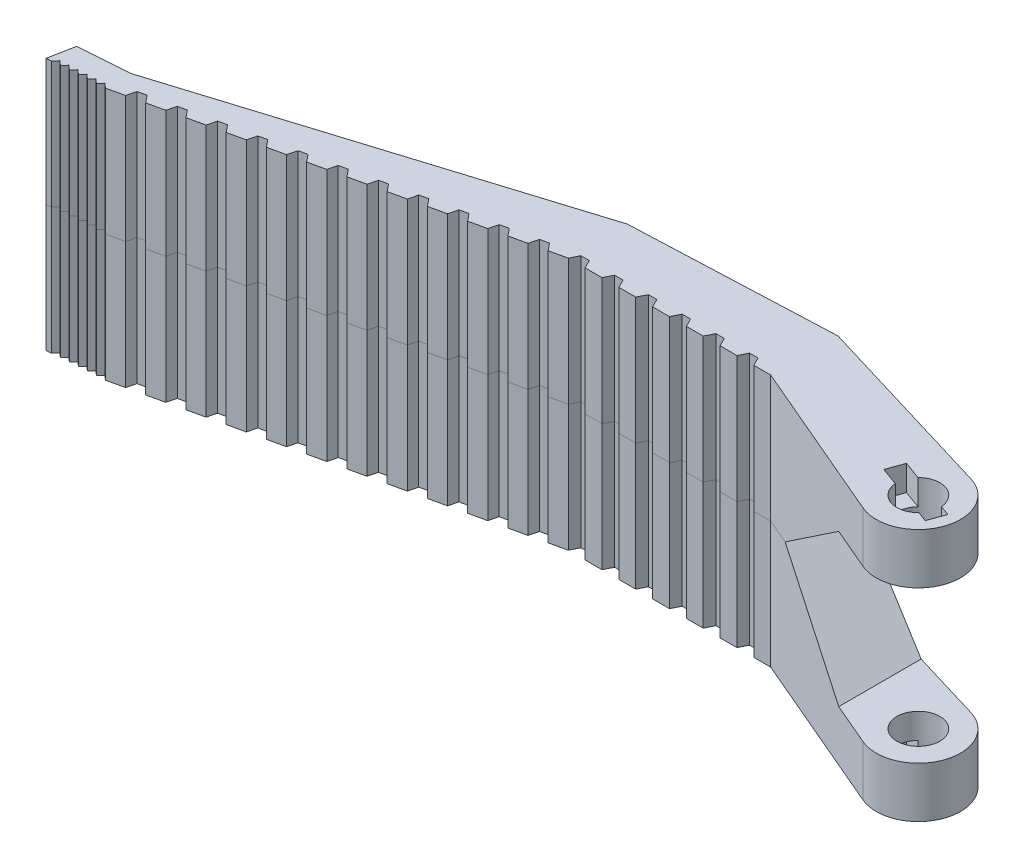
from build123d import *

# Parameters (mm, degrees)
EXTRUDE_2_DEPTH                = 15
EXTRUDE_2_DEPTH_BACK           = 15
CUT_EXTRUDE_7_DEPTH            = 99.424677187
CUT_EXTRUDE_7_DEPTH_BACK       = 99.424677187
SKETCH_5_R                     = 2.55
CUT_EXTRUDE_2_DEPTH            = 102.795958069
CUT_EXTRUDE_5_DEPTH            = 3
SPLIT_BODIES_1_SURFACE_1_BACK  = 108.515
SPLIT_BODIES_1_SURFACE_1_DEPTH = 217.03
SPLIT_BODIES_1_SURFACE_2_BACK  = 108.515
SPLIT_BODIES_1_SURFACE_2_DEPTH = 217.03


with BuildPart() as part:
    # 草图1 → 凸台-拉伸2 (new, two sides: drawn at the far end of the back side and taken through both)
    with BuildSketch(Plane(origin=(0, 0, 0), x_dir=(1, 0, 0), z_dir=(0, 1, 0)).offset(-EXTRUDE_2_DEPTH_BACK)):
        with BuildLine():
            Line((-1.965078437, -4.597658832), (-21.095395232, 3.57880106))
            Line((-21.095395232, 3.57880106), (-23.095395232, 3.57880106))
            Line((-23.095395232, 3.57880106), (-23.595395232, 4.57880106))
            Line((-23.595395232, 4.57880106), (-24.595395232, 4.57880106))
            Line((-24.595395232, 4.57880106), (-25.095395232, 3.57880106))
            Line((-25.095395232, 3.57880106), (-27.095395232, 3.57880106))
            Line((-27.095395232, 3.57880106), (-27.595395232, 4.57880106))
            Line((-27.595395232, 4.57880106), (-28.595395232, 4.57880106))
            Line((-28.595395232, 4.57880106), (-29.095395232, 3.57880106))
            Line((-29.095395232, 3.57880106), (-31.095395232, 3.57880106))
            Line((-31.095395232, 3.57880106), (-31.595395232, 4.57880106))
            Line((-31.595395232, 4.57880106), (-32.595395232, 4.57880106))
            Line((-32.595395232, 4.57880106), (-33.095395232, 3.57880106))
            Line((-33.095395232, 3.57880106), (-35.095395232, 3.57880106))
            Line((-35.095395232, 3.57880106), (-35.595395232, 4.57880106))
            Line((-35.595395232, 4.57880106), (-36.595395232, 4.57880106))
            Line((-36.595395232, 4.57880106), (-37.095395232, 3.57880106))
            Line((-37.095395232, 3.57880106), (-39.095395232, 3.57880106))
            Line((-39.095395232, 3.57880106), (-39.595395232, 4.57880106))
            Line((-39.595395232, 4.57880106), (-40.595395232, 4.57880106))
            Line((-40.595395232, 4.57880106), (-41.095395232, 3.57880106))
            Line((-41.095395232, 3.57880106), (-43.095395232, 3.57880106))
            Line((-43.095395232, 3.57880106), (-43.595395232, 4.57880106))
            Line((-43.595395232, 4.57880106), (-44.595395232, 4.57880106))
            Line((-44.595395232, 4.57880106), (-45.095395232, 3.57880106))
            Line((-45.095395232, 3.57880106), (-47.047769352, 3.144940144))
            Line((-47.047769352, 3.144940144), (-47.75279334, 4.012661975))
            Line((-47.75279334, 4.012661975), (-48.7289804, 3.795731517))
            Line((-48.7289804, 3.795731517), (-49.000143472, 2.711079228))
            Line((-49.000143472, 2.711079228), (-50.952517593, 2.277218313))
            Line((-50.952517593, 2.277218313), (-51.657541581, 3.144940144))
            Line((-51.657541581, 3.144940144), (-52.633728641, 2.928009686))
            Line((-52.633728641, 2.928009686), (-52.904891713, 1.843357397))
            Line((-52.904891713, 1.843357397), (-54.857265833, 1.409496481))
            Line((-54.857265833, 1.409496481), (-55.562289821, 2.277218313))
            Line((-55.562289821, 2.277218313), (-56.538476881, 2.060287855))
            Line((-56.538476881, 2.060287855), (-56.809639954, 0.975635566))
            Line((-56.809639954, 0.975635566), (-58.762014074, 0.54177465))
            Line((-58.762014074, 0.54177465), (-59.467038062, 1.409496481))
            Line((-59.467038062, 1.409496481), (-60.443225122, 1.192566024))
            Line((-60.443225122, 1.192566024), (-60.714388194, 0.107913735))
            Line((-60.714388194, 0.107913735), (-62.666762315, -0.325947181))
            Line((-62.666762315, -0.325947181), (-63.371786303, 0.54177465))
            Line((-63.371786303, 0.54177465), (-64.347973363, 0.324844192))
            Line((-64.347973363, 0.324844192), (-64.619136435, -0.759808097))
            Line((-64.619136435, -0.759808097), (-66.571510556, -1.193669012))
            Line((-66.571510556, -1.193669012), (-67.276534543, -0.325947181))
            Line((-67.276534543, -0.325947181), (-68.252721604, -0.542877639))
            Line((-68.252721604, -0.542877639), (-68.523884676, -1.627529928))
            Line((-68.523884676, -1.627529928), (-70.476258796, -2.061390844))
            Line((-70.476258796, -2.061390844), (-71.181282784, -1.193669012))
            Line((-71.181282784, -1.193669012), (-72.157469844, -1.41059947))
            Line((-72.157469844, -1.41059947), (-72.428632917, -2.495251759))
            Line((-72.428632917, -2.495251759), (-74.381007037, -2.929112675))
            Line((-74.381007037, -2.929112675), (-75.086031025, -2.061390844))
            Line((-75.086031025, -2.061390844), (-76.062218085, -2.278321301))
            Line((-76.062218085, -2.278321301), (-76.333381157, -3.362973591))
            Line((-76.333381157, -3.362973591), (-78.285755278, -3.796834506))
            Line((-78.285755278, -3.796834506), (-78.990779266, -2.929112675))
            Line((-78.990779266, -2.929112675), (-79.966966326, -3.146043133))
            Line((-79.966966326, -3.146043133), (-80.238129398, -4.230695422))
            Line((-80.238129398, -4.230695422), (-82.190503519, -4.664556337))
            Line((-82.190503519, -4.664556337), (-82.895527506, -3.796834506))
            Line((-82.895527506, -3.796834506), (-83.871714567, -4.013764964))
            Line((-83.871714567, -4.013764964), (-84.142877639, -5.098417253))
            Line((-84.142877639, -5.098417253), (-86.095251759, -5.532278169))
            Line((-86.095251759, -5.532278169), (-86.800275747, -4.664556337))
            Line((-86.800275747, -4.664556337), (-87.776462807, -4.881486795))
            Line((-87.776462807, -4.881486795), (-88.04762588, -5.966139084))
            Line((-88.04762588, -5.966139084), (-90, -6.4))
            Line((-90, -6.4), (-90.534206574, -5.93672542))
            Line((-90.534206574, -5.93672542), (-90.997481154, -6.470931993))
            Line((-90.997481154, -6.470931993), (-91.531687727, -6.007657413))
            Line((-91.531687727, -6.007657413), (-91.994962308, -6.541863986))
            Line((-91.994962308, -6.541863986), (-92.529168881, -6.078589406))
            Line((-92.529168881, -6.078589406), (-92.992443462, -6.612795979))
            Line((-92.992443462, -6.612795979), (-93.526650035, -6.149521399))
            Line((-93.526650035, -6.149521399), (-93.989924616, -6.683727973))
            Line((-93.989924616, -6.683727973), (-94.524131189, -6.220453392))
            Line((-94.524131189, -6.220453392), (-94.987405769, -6.754659966))
            Line((-94.987405769, -6.754659966), (-95.521612343, -6.291385385))
            Line((-95.521612343, -6.291385385), (-95.984886923, -6.825591959))
            Line((-95.984886923, -6.825591959), (-96.583375616, -6.868151155))
            Line((-96.583375616, -6.868151155), (-95.994348786, -3.818689182))
            Line((-95.994348786, -3.818689182), (-90, -3.39242438))
            Line((-90, -3.39242438), (-45.095395232, 10.57880106))
            Line((-45.095395232, 10.57880106), (-21.095395232, 11.57880106))
            Line((-21.095395232, 11.57880106), (1.442591054, 4.78737204))
            ThreePointArc((1.442591054, 4.78737204), (4.699781844, -1.706473152), (-1.965078437, -4.597658832))
        make_face()
    extrude(amount=EXTRUDE_2_DEPTH + EXTRUDE_2_DEPTH_BACK)

    # 草图10 → 切除-拉伸7 (cut, two sides: drawn at the far end of the back side and taken through both)
    with BuildSketch(Plane.XY.offset(-CUT_EXTRUDE_7_DEPTH_BACK)):
        Polygon((5, 9), (-7, 9), (-18.095395232, 0), (-7, -9), (5, -9), align=None)
    extrude(amount=CUT_EXTRUDE_7_DEPTH + CUT_EXTRUDE_7_DEPTH_BACK, mode=Mode.SUBTRACT)

    # 草图5 → 切除-拉伸2 (cut, through all)
    with BuildSketch(Plane.XZ.offset(15)):
        Circle(SKETCH_5_R)
    extrude(amount=-CUT_EXTRUDE_2_DEPTH, mode=Mode.SUBTRACT)

    # 草图8 → 切除-拉伸5 (cut)
    with BuildSketch(Plane.XZ.offset(15)):
        Polygon((-4.682158658, -0.583001112), (-3.965439935, -2.556909487), (3.74220229, 0.241706482), (3.025483566, 2.215614856), align=None)
    cut_extrude_5 = extrude(amount=-CUT_EXTRUDE_5_DEPTH, mode=Mode.SUBTRACT)

    # 镜向1: 切除-拉伸5 across plane
    add(cut_extrude_5.mirror(Plane.ZX), mode=Mode.SUBTRACT)


with BuildPart() as body_2:
    # Split Bodies 1: the piece behind the surface
    add(part.part)
    # Split Bodies 1 surface: a surface, the sketch's curves swept straight by 217.03 mm
    with BuildLine(Plane.XY.offset(-SPLIT_BODIES_1_SURFACE_1_BACK), mode=Mode.PRIVATE) as split_bodies_1_surface_1_path:
        Line((-97.313256612, 0), (15.621875769, 0))
    split_bodies_1_surface_1 = Shell.extrude(split_bodies_1_surface_1_path.wire(), (0 * SPLIT_BODIES_1_SURFACE_1_DEPTH, 0 * SPLIT_BODIES_1_SURFACE_1_DEPTH, 1 * SPLIT_BODIES_1_SURFACE_1_DEPTH))
    split(bisect_by=split_bodies_1_surface_1, keep=Keep.BOTTOM)


with BuildPart() as part_1:
    add(part.part)

    # Split Bodies 1: split by a surface, the side it looks to stays
    # Split Bodies 1 surface: a surface, the sketch's curves swept straight by 217.03 mm
    with BuildLine(Plane.XY.offset(-SPLIT_BODIES_1_SURFACE_2_BACK), mode=Mode.PRIVATE) as split_bodies_1_surface_2_path:
        Line((-97.313256612, 0), (15.621875769, 0))
    split_bodies_1_surface_2 = Shell.extrude(split_bodies_1_surface_2_path.wire(), (0 * SPLIT_BODIES_1_SURFACE_2_DEPTH, 0 * SPLIT_BODIES_1_SURFACE_2_DEPTH, 1 * SPLIT_BODIES_1_SURFACE_2_DEPTH))
    split(bisect_by=split_bodies_1_surface_2, keep=Keep.TOP)


solid = Compound([body_2.part, part_1.part])
